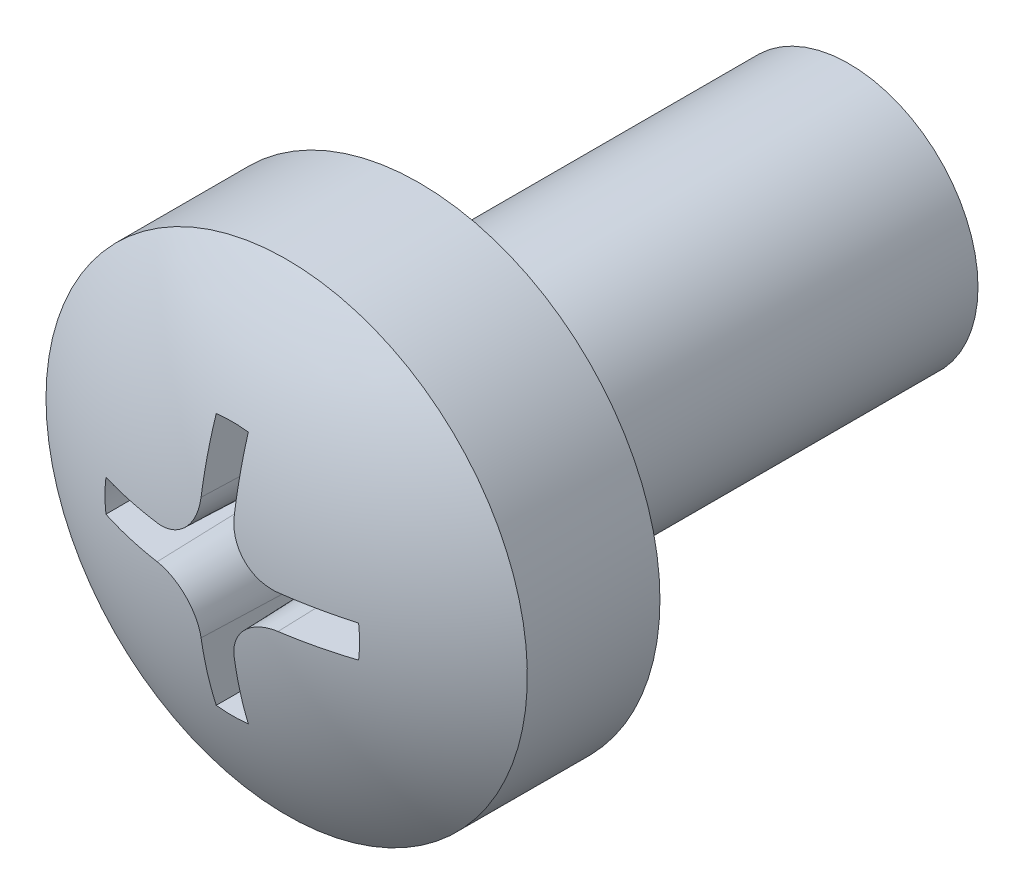
from build123d import *

# Parameters (mm, degrees)
BASE_EXTRUDE_DEPTH      = 5
BASE_EXTRUDE_DEPTH_BACK = 0.0001
SKETCH1_R               = 1.5
CUT_EXTRUDE1_DEPTH      = 1.799999969
CUT_EXTRUDE1_TAPER      = 2


with BuildPart() as part:
    # Sketch1 → Base-Extrude (new, two sides: drawn at the far end of the back side and taken through both)
    with BuildSketch(Plane.XY.offset(-BASE_EXTRUDE_DEPTH_BACK)):
        Circle(SKETCH1_R)
    extrude(amount=BASE_EXTRUDE_DEPTH + BASE_EXTRUDE_DEPTH_BACK)

    # Sketch6 → Boss-Revolve2 (revolve)
    with BuildSketch(Plane(origin=(0, 0, 0), x_dir=(1, 0, 0), z_dir=(0, 1, 0))):
        with BuildLine():
            Line((0, -5), (2.7999999, -5))
            Line((2.7999999, -5), (2.7999999, -6.54246308))
            ThreePointArc((2.7999999, -6.54246308), (1.46418655, -7.180811406), (0, -7.4))
            Line((0, -7.4), (0, -5))
        make_face()
    revolve(axis=Axis((0, 0, -0.393620135), (0, 0, 1)))

    # Sketch7 → Cut-Extrude1 (cut)
    with BuildSketch(Plane(origin=(0, 0, 7.7000001), x_dir=(-1, 0, 0), z_dir=(0, 0, -1))):
        with BuildLine():
            ThreePointArc((0.205000004, 1.48592565), (0, 1.500000013), (-0.205000004, 1.48592565))
            Line((-0.205000004, 1.48592565), (-0.205000004, 0.708178558))
            ThreePointArc((-0.205000004, 0.708178558), (-0.35072876, 0.355344481), (-0.702967546, 0.208182689))
            Line((-0.702967546, 0.208182689), (-1.48592565, 0.205000004))
            ThreePointArc((-1.48592565, 0.205000004), (-1.500000013, 0), (-1.48592565, -0.205000004))
            Line((-1.48592565, -0.205000004), (-0.702967546, -0.208182689))
            ThreePointArc((-0.702967546, -0.208182689), (-0.35072876, -0.355344481), (-0.205000004, -0.708178558))
            Line((-0.205000004, -0.708178558), (-0.205000004, -1.48592565))
            ThreePointArc((-0.205000004, -1.48592565), (0, -1.500000013), (0.205000004, -1.48592565))
            Line((0.205000004, -1.48592565), (0.205000004, -0.708178558))
            ThreePointArc((0.205000004, -0.708178558), (0.35072876, -0.355344481), (0.702967546, -0.208182689))
            Line((0.702967546, -0.208182689), (1.48592565, -0.205000004))
            ThreePointArc((1.48592565, -0.205000004), (1.500000013, 0), (1.48592565, 0.205000004))
            Line((1.48592565, 0.205000004), (0.702967546, 0.208182689))
            ThreePointArc((0.702967546, 0.208182689), (0.35072876, 0.355344481), (0.205000004, 0.708178558))
            Line((0.205000004, 0.708178558), (0.205000004, 1.48592565))
        make_face()
    extrude(amount=CUT_EXTRUDE1_DEPTH, taper=CUT_EXTRUDE1_TAPER, mode=Mode.SUBTRACT)


solid = part.part
